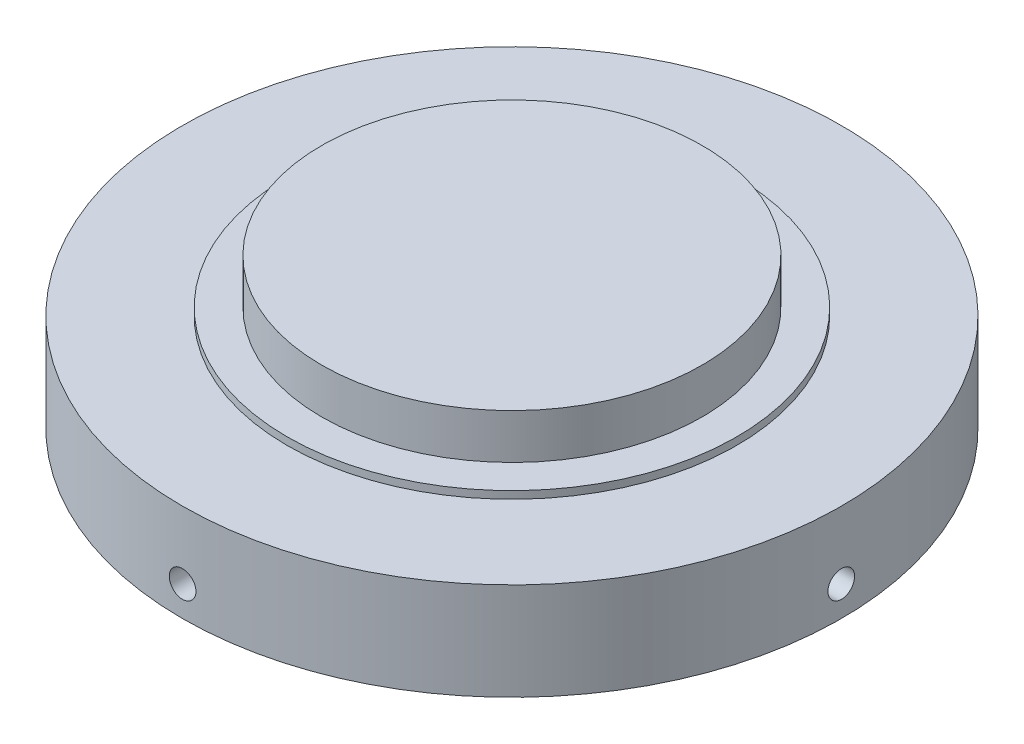
from build123d import *

# Parameters (mm, degrees)
SKETCH_2_R               = 22
EXTRUDE_1_DEPTH          = 10
SKETCH_3_R               = 20
CUT_EXTRUDE_1_DEPTH      = 4
CUT_EXTRUDE_START        = -3
SKETCH_4_R               = 22
SKETCH_4_R_2             = 12.7
CUT_EXTRUDE_2_DEPTH      = 3
SKETCH_9_R               = 20.15
CUT_EXTRUDE_3_DEPTH      = 4
CUT_EXTRUDE_START_2      = -0.5
SKETCH_10_R              = 22
SKETCH_10_R_2            = 15
CUT_EXTRUDE_4_DEPTH      = 0.5
PATTERN_CIRCULAR_1_COUNT = 4


with BuildPart() as part:
    # 草图2 → 凸台-拉伸1 (new body)
    with BuildSketch(Plane(origin=(0, 0, 0), x_dir=(1, 0, 0), z_dir=(0, 1, 0))):
        with Locations(Location((0, 0, 0), (0, 0, 270))):
            Circle(SKETCH_2_R)
    extrude(amount=EXTRUDE_1_DEPTH)

    # 草图3 → 切除-拉伸1 (cut)
    with BuildSketch(Plane.XZ):
        with Locations(Location((0, 0, 0), (0, 0, 270))):
            Circle(SKETCH_3_R)
    extrude(amount=-CUT_EXTRUDE_1_DEPTH, mode=Mode.SUBTRACT)

    # 草图4 → 切除-拉伸2 (cut)
    with BuildSketch(Plane(origin=(0, 10, 0), x_dir=(1, 0, 0), z_dir=(0, 1, 0)).offset(CUT_EXTRUDE_START)):
        with Locations(Location((0, 0, 0), (0, 0, 270))):
            Circle(SKETCH_4_R)
        with Locations(Location((0, 0, 0), (0, 0, 270))):
            Circle(SKETCH_4_R_2, mode=Mode.SUBTRACT)
    extrude(amount=CUT_EXTRUDE_2_DEPTH, mode=Mode.SUBTRACT)

    # 草图9 → 切除-拉伸3 (cut)
    with BuildSketch(Plane.XZ):
        with Locations(Location((0, 0, 0), (0, 0, 270))):
            Circle(SKETCH_9_R)
    extrude(amount=-CUT_EXTRUDE_3_DEPTH, mode=Mode.SUBTRACT)

    # 草图10 → 切除-拉伸4 (cut)
    with BuildSketch(Plane(origin=(0, 7, 0), x_dir=(1, 0, 0), z_dir=(0, 1, 0)).offset(CUT_EXTRUDE_START_2)):
        with Locations(Location((0, 0, 0), (0, 0, 270))):
            Circle(SKETCH_10_R)
        with Locations(Location((0, 0, 0), (0, 0, 270))):
            Circle(SKETCH_10_R_2, mode=Mode.SUBTRACT)
    extrude(amount=CUT_EXTRUDE_4_DEPTH, mode=Mode.SUBTRACT)

    # 草图7 → #2-56 螺纹孔1 (revolve, cut)
    with BuildSketch(Plane(origin=(0, 2, -22), x_dir=(0, 1, 0), z_dir=(1, 0, 0))):
        Polygon((0, 0), (0, 5.53416509), (0.889, 5), (0.889, 0), align=None)
    hole_wizard_2_56_1 = revolve(axis=Axis((0, 2, -28.35), (0, 0, 1)), mode=Mode.SUBTRACT)

    # 阵列(圆周)1: #2-56 螺纹孔1 ×4 about axis
    pattern_circular_1_axis = Axis((0, 0, 0), (0, 1, 0))
    for i in range(1, PATTERN_CIRCULAR_1_COUNT):
        add(hole_wizard_2_56_1.rotate(pattern_circular_1_axis, i * 360 / PATTERN_CIRCULAR_1_COUNT), mode=Mode.SUBTRACT)


solid = part.part
